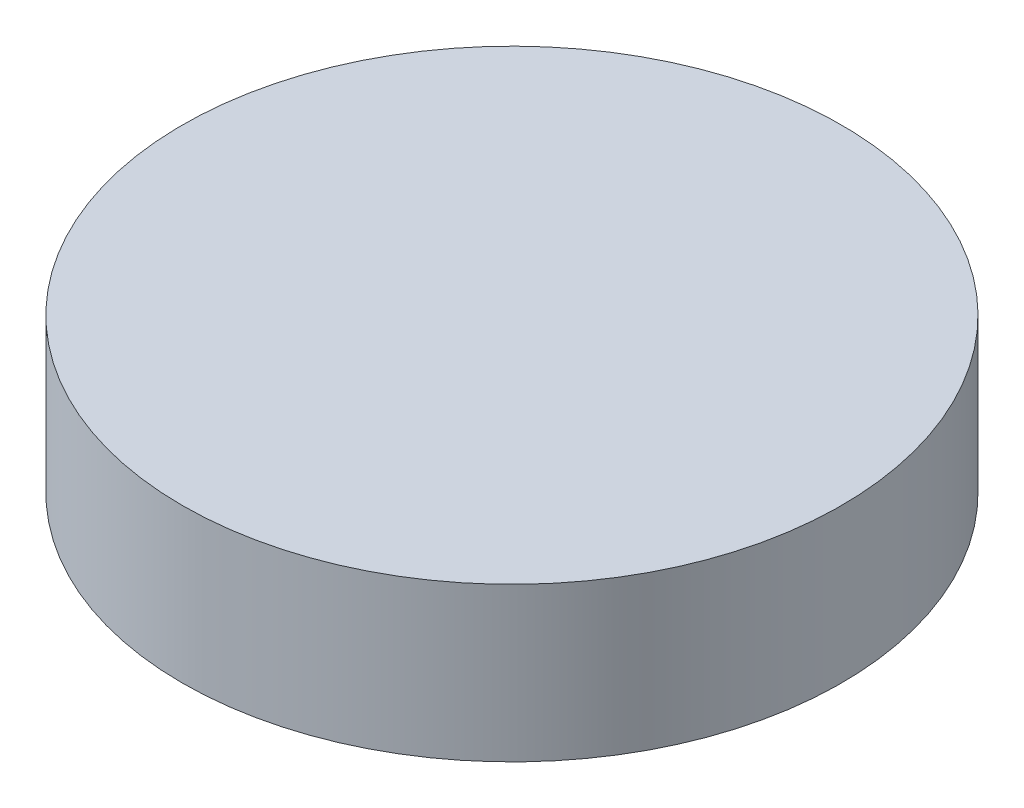
from build123d import *

# Parameters (mm, degrees)
SKETCH1_R           = 75
BOSS_EXTRUDE1_DEPTH = 17.5


with BuildPart() as part:
    # Sketch1 → Boss-Extrude1 (new, symmetric)
    with BuildSketch(Plane(origin=(0, 0, 0), x_dir=(1, 0, 0), z_dir=(0, 1, 0))):
        with Locations(Location((0, 0, 0), (0, 0, 270))):
            Circle(SKETCH1_R)
    extrude(amount=BOSS_EXTRUDE1_DEPTH, both=True)


solid = part.part
